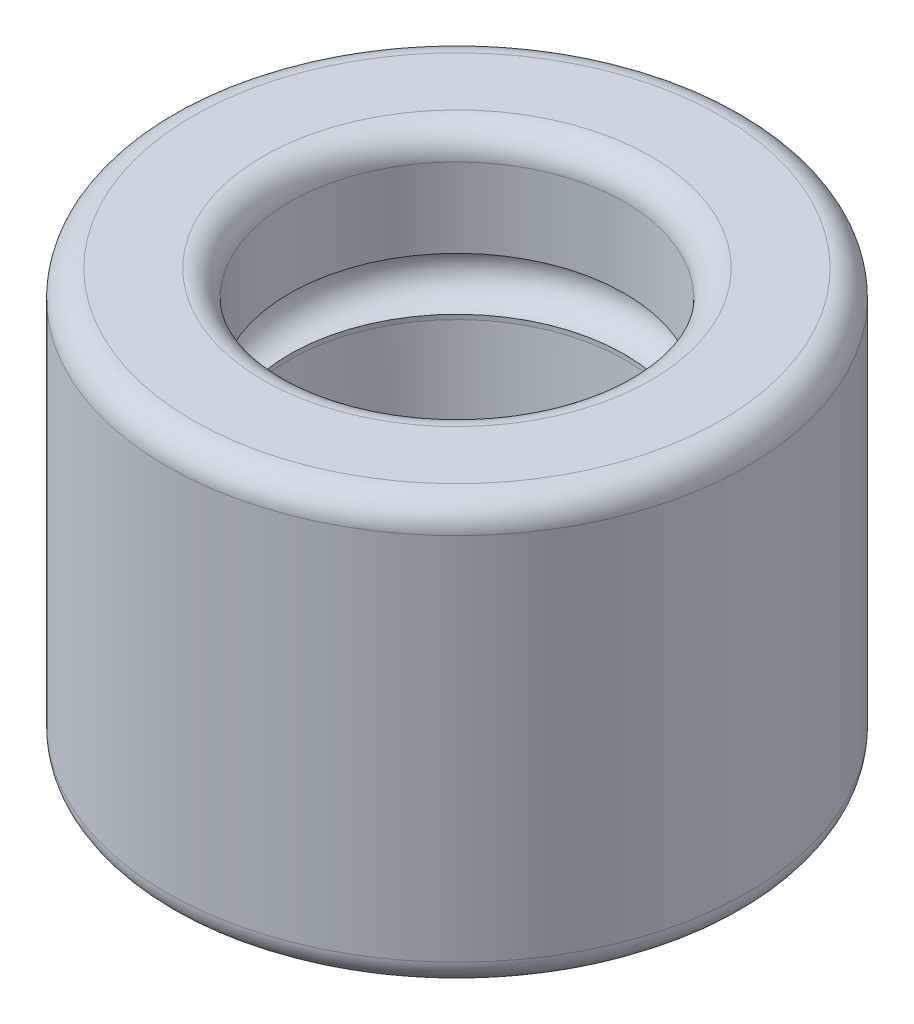
from build123d import *

# Parameters (mm, degrees)
CHAMFER1_SIZE  = 0.3
CHAMFER1_SIZE2 = 3.429015691
FILLET1_R      = 0.5


with BuildPart() as part:
    # Sketch3 → Revolve1 (revolve)
    with BuildSketch(Plane.XY, mode=Mode.PRIVATE) as revolve1_sk:
        with BuildLine():
            Line((0, 0), (-5.5, 0))
            Line((-5.5, 0), (-5.5, 8))
            Line((-5.5, 8), (-3.175, 8))
            Line((-3.175, 8), (-3.175, 6))
            ThreePointArc((-3.175, 6), (-3.675, 5.5), (-3.175, 5))
            Line((-3.175, 5), (-3.175, 1.483219346))
            Line((-3.175, 1.483219346), (0, 1.483219346))
            Line((0, 1.483219346), (0, 0))
        make_face()
    revolve(revolve1_sk.sketch.rotate(Axis((0, 0, 0), (0, 1, 0)), 270), axis=Axis((0, 0, 0), (0, 1, 0)))

    # Chamfer1
    chamfer1_edges = [part.edges().sort_by_distance(p)[0] for p in [
        (0, 1.483219346, 3.175),
    ]]
    chamfer1_side = [part.faces().sort_by_distance(p)[0] for p in [
        (0, 1.483219346, 0),
    ]]
    chamfer(chamfer1_edges, length=CHAMFER1_SIZE, length2=CHAMFER1_SIZE2, reference=chamfer1_side[0])

    # Fillet1
    fillet1_edges = [part.edges().sort_by_distance(p)[0] for p in [
        (0, 0, 5.5),
        (0, 8, 5.5),
        (0, 8, 3.175),
    ]]
    fillet(fillet1_edges, radius=FILLET1_R)


solid = part.part
